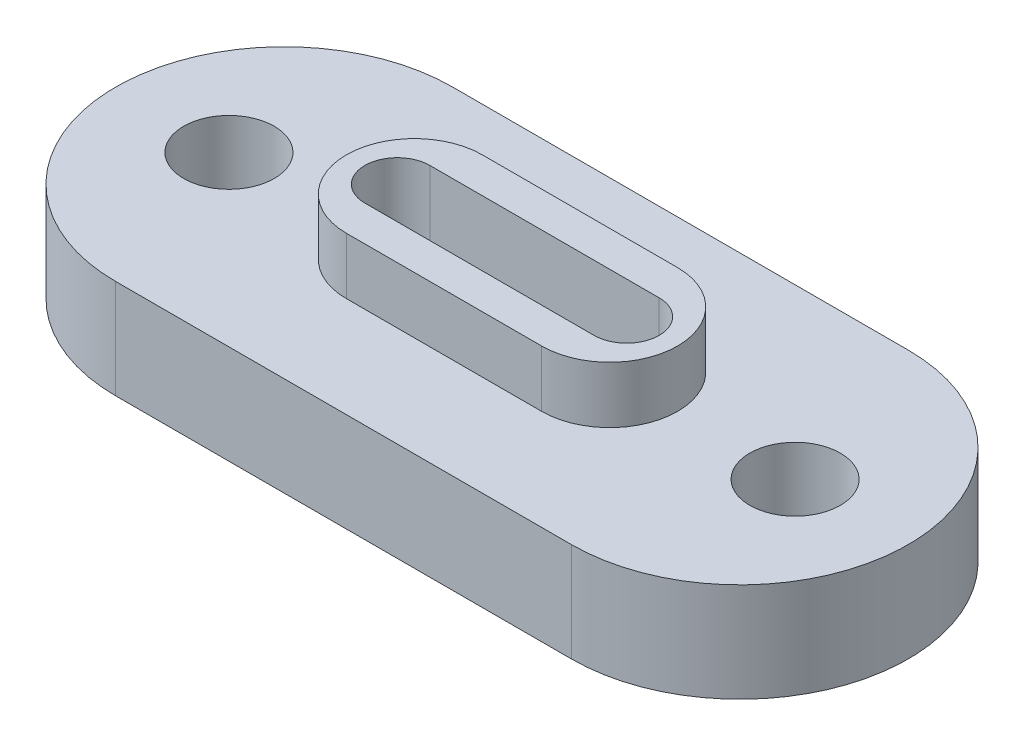
from build123d import *

# Parameters (mm, degrees)
BOSS_EXTRUDE1_DEPTH = 2
BOSS_EXTRUDE2_START = 3.5
SKETCH2_R           = 1.6
BOSS_EXTRUDE2_DEPTH = 3.5


with BuildPart() as part:
    # Sketch1 → Boss-Extrude1 (new body)
    with BuildSketch(Plane(origin=(0, 0, 0), x_dir=(1, 0, 0), z_dir=(0, 1, 0))):
        with BuildLine():
            Line((-3.45, 2.4), (3.45, 2.4))
            ThreePointArc((3.45, 2.4), (5.85, 0), (3.45, -2.4))
            Line((3.45, -2.4), (-3.45, -2.4))
            ThreePointArc((-3.45, -2.4), (-5.85, 0), (-3.45, 2.4))
        make_face()
        with BuildLine():
            Line((-4.05, 1.15), (4.05, 1.15))
            ThreePointArc((4.05, 1.15), (5.2, 0), (4.05, -1.15))
            Line((4.05, -1.15), (-4.05, -1.15))
            ThreePointArc((-4.05, -1.15), (-5.2, 0), (-4.05, 1.15))
        make_face(mode=Mode.SUBTRACT)
    extrude(amount=BOSS_EXTRUDE1_DEPTH)

    # Sketch2 → Boss-Extrude2 (add)
    with BuildSketch(Plane.XZ.offset(BOSS_EXTRUDE2_START)):
        with BuildLine():
            Line((-8.05, 5.95), (8.05, 5.95))
            ThreePointArc((8.05, 5.95), (14, 0), (8.05, -5.95))
            Line((8.05, -5.95), (-8.05, -5.95))
            ThreePointArc((-8.05, -5.95), (-14, 0), (-8.05, 5.95))
        make_face()
        with Locations(Location((-10, 0, 0), (0, 0, 270))):
            Circle(SKETCH2_R, mode=Mode.SUBTRACT)
        with Locations(Location((10, 0, 0), (0, 0, 270))):
            Circle(SKETCH2_R, mode=Mode.SUBTRACT)
        with BuildLine():
            Line((4.05, -1.15), (-4.05, -1.15))
            ThreePointArc((-4.05, -1.15), (-5.2, 0), (-4.05, 1.15))
            Line((-4.05, 1.15), (4.05, 1.15))
            ThreePointArc((4.05, 1.15), (5.2, 0), (4.05, -1.15))
        make_face(mode=Mode.SUBTRACT)
    extrude(amount=-BOSS_EXTRUDE2_DEPTH)


solid = part.part
